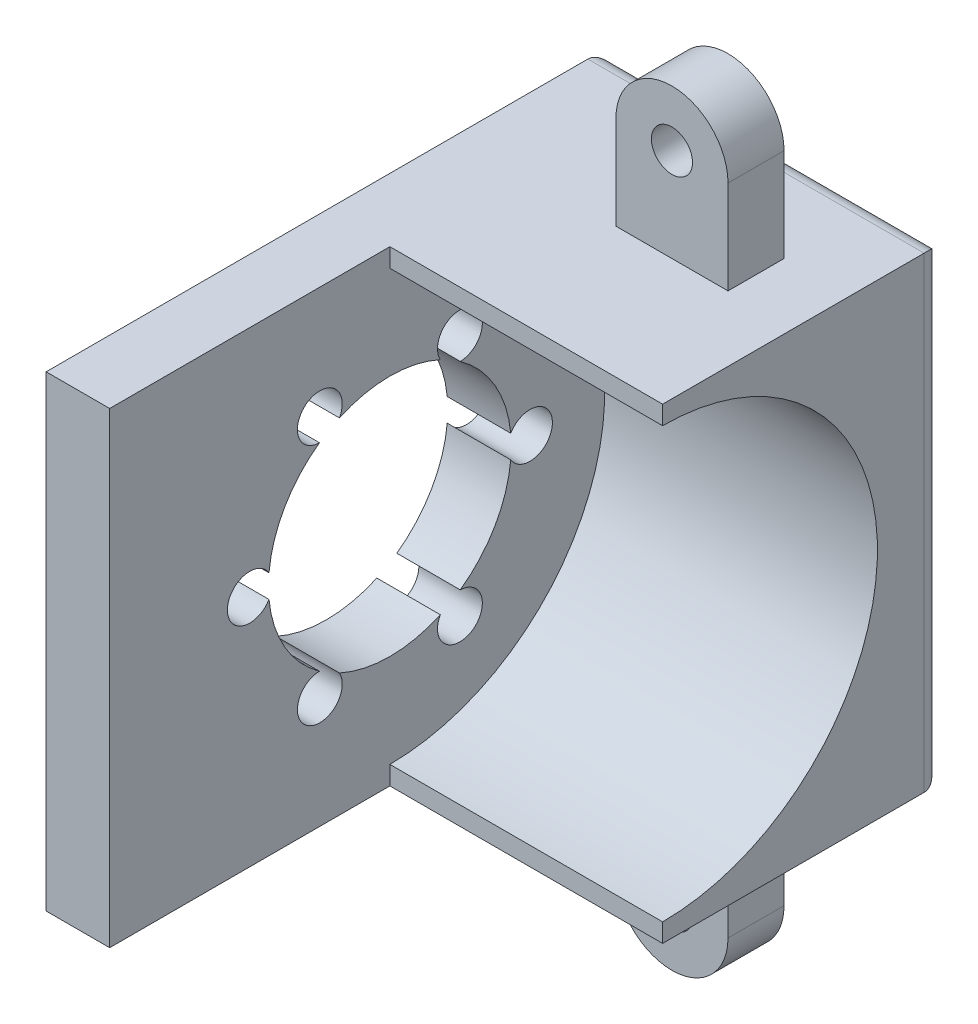
from build123d import *

# Parameters (mm, degrees)
SKETCH_1_W          = 23
SKETCH_1_H          = 25
EXTRUDE_1_DEPTH     = 15
SKETCH_2_W          = 19.6
SKETCH_2_H          = 11.5
SKETCH_4_W          = 3.4
SKETCH_4_H          = 25
EXTRUDE_2_DEPTH     = 15
CUT_EXTRUDE_1_DEPTH = 4
SKETCH_8_R          = 1.1
EXTRUDE_3_DEPTH     = 8
SKETCH_8_2_R        = 1.1
CUT_EXTRUDE_4_DEPTH = 5
SKETCH_7_W          = 35
SKETCH_7_H          = 40
CUT_EXTRUDE_3_DEPTH = 5
FILLET_1_R          = 1


with BuildPart() as part:
    # 草图1 → 凸台-拉伸1 (new body)
    with BuildSketch(Plane.XY):
        Rectangle(SKETCH_1_W, SKETCH_1_H)
    extrude(amount=-EXTRUDE_1_DEPTH)

    # 草图2 → 切除-旋转2 (revolve, cut)
    with BuildSketch(Plane.XY):
        with Locations((1.7, -5.75)):
            Rectangle(SKETCH_2_W, SKETCH_2_H)
    revolve(axis=Axis((11.5, 0, 0), (-1, 0, 0)), mode=Mode.SUBTRACT)

    # 草图4 → 凸台-拉伸2 (add)
    with BuildSketch(Plane.XY):
        with Locations((-9.8, 0)):
            Rectangle(SKETCH_4_W, SKETCH_4_H)
    extrude(amount=EXTRUDE_2_DEPTH)

    # 草图6 → 切除-拉伸1 (cut)
    with BuildSketch(Plane(origin=(-8.1, 0, 0), x_dir=(0, 0, -1), z_dir=(1, 0, 0))):
        with BuildLine():
            ThreePointArc((6.470666667, -0.616824845), (8.7, 0), (6.470666667, 0.616824845))
            ThreePointArc((6.470666667, 0.616824845), (5.629165125, 3.25), (3.769519318, 5.29534929))
            ThreePointArc((3.769519318, 5.29534929), (4.35, 7.534421013), (2.701147348, 5.912174135))
            ThreePointArc((2.701147348, 5.912174135), (0, 6.5), (-2.701147348, 5.912174135))
            ThreePointArc((-2.701147348, 5.912174135), (-4.35, 7.534421013), (-3.769519318, 5.29534929))
            ThreePointArc((-3.769519318, 5.29534929), (-5.629165125, 3.25), (-6.470666667, 0.616824845))
            ThreePointArc((-6.470666667, 0.616824845), (-8.7, 0), (-6.470666667, -0.616824845))
            ThreePointArc((-6.470666667, -0.616824845), (-5.629165125, -3.25), (-3.769519318, -5.29534929))
            ThreePointArc((-3.769519318, -5.29534929), (-4.35, -7.534421013), (-2.701147348, -5.912174135))
            ThreePointArc((-2.701147348, -5.912174135), (0, -6.5), (2.701147348, -5.912174135))
            ThreePointArc((2.701147348, -5.912174135), (4.35, -7.534421013), (3.769519318, -5.29534929))
            ThreePointArc((3.769519318, -5.29534929), (5.629165125, -3.25), (6.470666667, -0.616824845))
        make_face()
    extrude(amount=-CUT_EXTRUDE_1_DEPTH, mode=Mode.SUBTRACT)

    # 草图8 → 凸台-拉伸3 (add)
    # profile 1 of 2: a face of its own
    with BuildSketch(Plane(origin=(0, 0, -15), x_dir=(-1, 0, 0), z_dir=(0, 0, -1))):
        with BuildLine():
            Line((3, 17.5), (3, 12.5))
            Line((3, 12.5), (-3, 12.5))
            Line((-3, 12.5), (-3, 17.5))
            ThreePointArc((-3, 17.5), (0, 20.5), (3, 17.5))
        make_face()
        with Locations((0, 17.5)):
            Circle(SKETCH_8_R, mode=Mode.SUBTRACT)
    # profile 2 of 2: a face of its own
    with BuildSketch(Plane(origin=(0, 0, -15), x_dir=(-1, 0, 0), z_dir=(0, 0, -1))):
        with BuildLine():
            Line((-3, -17.5), (-3, -12.5))
            Line((-3, -12.5), (3, -12.5))
            Line((3, -12.5), (3, -17.5))
            ThreePointArc((3, -17.5), (0, -20.5), (-3, -17.5))
        make_face()
        with Locations((0, -17.5)):
            Circle(SKETCH_8_R, mode=Mode.SUBTRACT)
    extrude(amount=-EXTRUDE_3_DEPTH)

    # 草图8<2> → 切除-拉伸4 (cut)
    # profile 1 of 2: a face of its own
    with BuildSketch(Plane(origin=(0, 0, -15), x_dir=(-1, 0, 0), z_dir=(0, 0, -1))):
        with BuildLine():
            Line((3, 17.5), (3, 12.5))
            Line((3, 12.5), (-3, 12.5))
            Line((-3, 12.5), (-3, 17.5))
            ThreePointArc((-3, 17.5), (0, 20.5), (3, 17.5))
        make_face()
        with Locations((0, 17.5)):
            Circle(SKETCH_8_2_R, mode=Mode.SUBTRACT)
    # profile 2 of 2: a face of its own
    with BuildSketch(Plane(origin=(0, 0, -15), x_dir=(-1, 0, 0), z_dir=(0, 0, -1))):
        with BuildLine():
            Line((-3, -17.5), (-3, -12.5))
            Line((-3, -12.5), (3, -12.5))
            Line((3, -12.5), (3, -17.5))
            ThreePointArc((3, -17.5), (0, -20.5), (-3, -17.5))
        make_face()
        with Locations((0, -17.5)):
            Circle(SKETCH_8_2_R, mode=Mode.SUBTRACT)
    extrude(amount=-CUT_EXTRUDE_4_DEPTH, mode=Mode.SUBTRACT)

    # 草图7 → 切除-拉伸3 (cut)
    with BuildSketch(Plane(origin=(11.5, 0, 0), x_dir=(0, 0, -1), z_dir=(1, 0, 0))):
        with Locations((11.5, 0)):
            Rectangle(SKETCH_7_W, SKETCH_7_H)
    extrude(amount=-CUT_EXTRUDE_3_DEPTH, mode=Mode.SUBTRACT)

    # 圆角1
    fillet_1_edges = [part.edges().sort_by_distance(p)[0] for p in [
        (-2.5, -12.5, -15),
        (-11.5, 0, -15),
        (-2.5, 12.5, -15),
        (6.5, 0, -15),
    ]]
    fillet(fillet_1_edges, radius=FILLET_1_R)


solid = part.part
